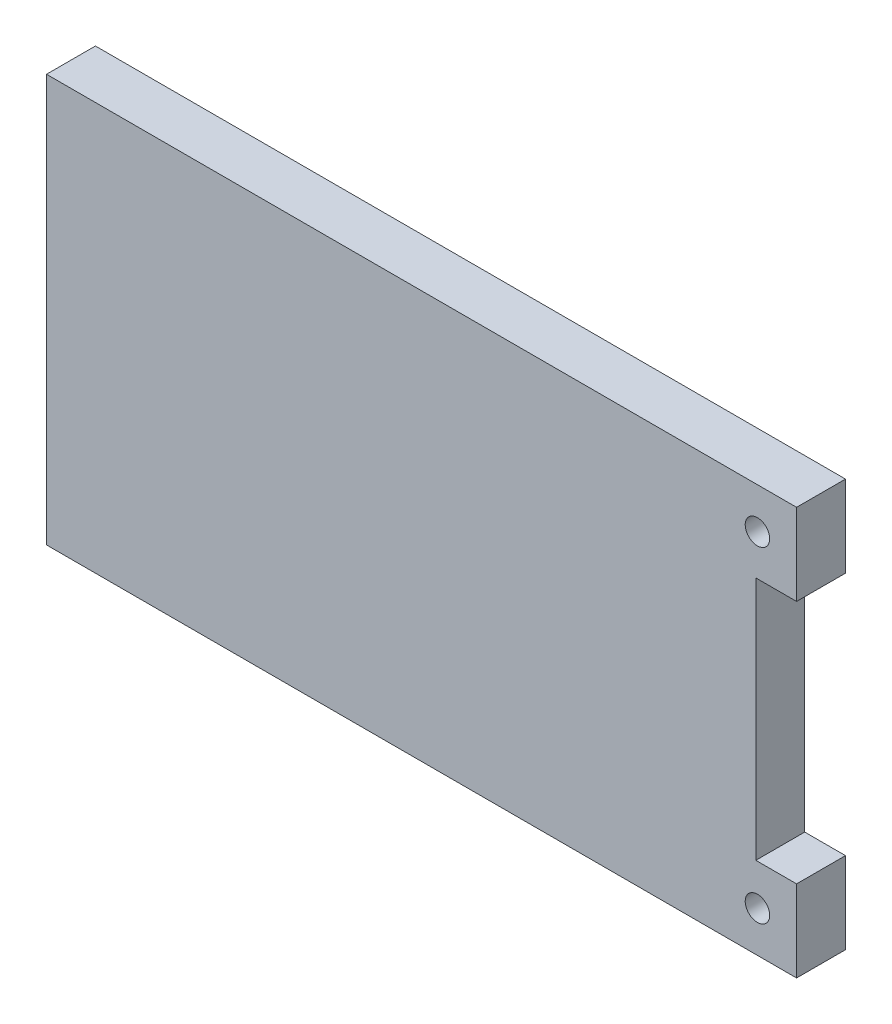
from build123d import *

# Parameters (mm, degrees)
SKETCH1_R           = 0.15
BOSS_EXTRUDE1_DEPTH = 0.6


with BuildPart() as part:
    # Sketch1 → Boss-Extrude1 (new body)
    with BuildSketch(Plane.XY):
        Polygon((148.35, 52.1), (148.35, 51.1), (147.85, 51.1), (147.85, 48.1), (148.35, 48.1), (148.35, 47.1), (146.55, 47.1), (146.05, 47.1), (140.55, 47.1), (140.05, 47.1), (139.15, 47.1), (139.15, 48.3), (139.15, 49.3), (139.15, 52.1), align=None)
        with Locations((147.87, 47.6)):
            Circle(SKETCH1_R, mode=Mode.SUBTRACT)
        with Locations((147.87, 51.6)):
            Circle(SKETCH1_R, mode=Mode.SUBTRACT)
    extrude(amount=BOSS_EXTRUDE1_DEPTH)


solid = part.part
